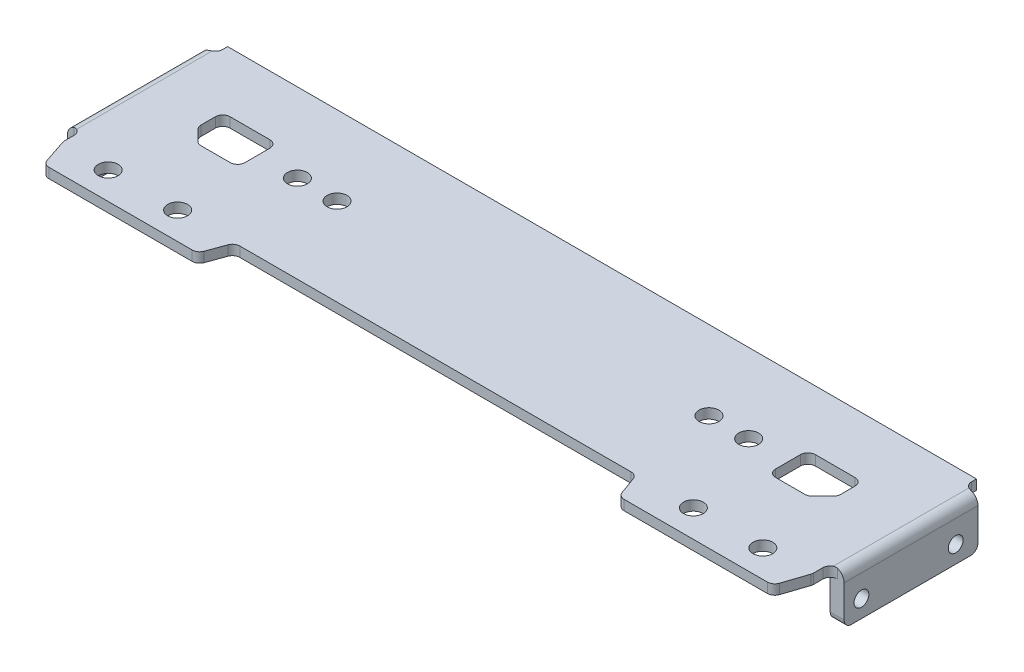
from build123d import *

# Parameters (mm, degrees)
SKETCH1_R           = 2
BOSS_EXTRUDE1_DEPTH = 2
SKETCH2_W           = 2.8
SKETCH2_H           = 27
BOSS_EXTRUDE2_DEPTH = 10
SKETCH3_R           = 1.5
CUT_EXTRUDE1_DEPTH  = 114.824325613
FILLET1_R           = 1.5
FILLET2_R           = 2
SKETCH4_W           = 118.780737261
SKETCH4_H           = 53.902552227
CUT_EXTRUDE2_DEPTH  = 171
SKETCH5_W           = 33.594975397
SKETCH5_H           = 2
BOSS_EXTRUDE3_DEPTH = 25


with BuildPart() as part:
    # Sketch1 → Boss-Extrude1 (new body)
    with BuildSketch(Plane(origin=(0, 0, 0), x_dir=(1, 0, 0), z_dir=(0, 1, 0))):
        Polygon((0, 6), (2, 0), (33, 0), (35, 5.5), (66, 5.5), (68, 0), (99, 0), (101, 6), (101, 39.094975397), (0, 39.094975397), align=None)
        with Locations(Location((9.5, 5.5, 0), (0, 0, 270))):
            Circle(SKETCH1_R, mode=Mode.SUBTRACT)
        with Locations(Location((23.5, 5.5, 0), (0, 0, 270))):
            Circle(SKETCH1_R, mode=Mode.SUBTRACT)
        with Locations(Location((77.5, 5.5, 0), (0, 0, 90))):
            Circle(SKETCH1_R, mode=Mode.SUBTRACT)
        with Locations(Location((91.5, 5.5, 0), (0, 0, 90))):
            Circle(SKETCH1_R, mode=Mode.SUBTRACT)
        with Locations(Location((30, 23.149785568, 0), (0, 0, 270))):
            Circle(SKETCH1_R, mode=Mode.SUBTRACT)
        with Locations(Location((38, 23.149785568, 0), (0, 0, 270))):
            Circle(SKETCH1_R, mode=Mode.SUBTRACT)
        with Locations(Location((63, 23.149785568, 0), (0, 0, 90))):
            Circle(SKETCH1_R, mode=Mode.SUBTRACT)
        with Locations(Location((71, 23.149785568, 0), (0, 0, 90))):
            Circle(SKETCH1_R, mode=Mode.SUBTRACT)
        Polygon((11, 22.094975397), (14, 19.094975397), (22, 19.094975397), (22, 27.094975397), (11, 27.094975397), align=None, mode=Mode.SUBTRACT)
        Polygon((90, 27.094975397), (90, 22.094975397), (87, 19.094975397), (79, 19.094975397), (79, 27.094975397), align=None, mode=Mode.SUBTRACT)
    extrude(amount=BOSS_EXTRUDE1_DEPTH)

    # Sketch2 → Boss-Extrude2 (add)
    with BuildSketch(Plane(origin=(0, 2, 0), x_dir=(1, 0, 0), z_dir=(0, 1, 0))):
        with Locations((-1.4, 23.094975397)):
            Rectangle(SKETCH2_W, SKETCH2_H)
        with Locations((102.4, 23.094975397)):
            Rectangle(SKETCH2_W, SKETCH2_H)
    extrude(amount=-BOSS_EXTRUDE2_DEPTH)

    # Sketch3 → Cut-Extrude1 (cut, through all)
    with BuildSketch(Plane(origin=(103.8, 0, 0), x_dir=(0, 0, -1), z_dir=(1, 0, 0))):
        with Locations((13.094975397, -4.5)):
            Circle(SKETCH3_R)
        with Locations((32.094975397, -4.5)):
            Circle(SKETCH3_R)
    extrude(amount=-CUT_EXTRUDE1_DEPTH, mode=Mode.SUBTRACT)

    # Fillet1
    fillet1_edges = [part.edges().sort_by_distance(p)[0] for p in [
        (-1.4, -8, -9.594975397),
        (-1.4, -8, -36.594975397),
        (0, 1, -9.594975397),
        (0, 1, -6),
        (2, 1, 0),
        (0, 1, -36.594975397),
        (102.4, -8, -36.594975397),
        (101, 1, -36.594975397),
        (102.4, -8, -9.594975397),
        (101, 1, -9.594975397),
        (101, 1, -6),
        (99, 1, 0),
        (66, 1, -5.5),
        (68, 1, 0),
        (90, 1, -27.094975397),
        (79, 1, -27.094975397),
        (90, 1, -22.094975397),
        (87, 1, -19.094975397),
        (79, 1, -19.094975397),
        (35, 1, -5.5),
        (33, 1, 0),
        (11, 1, -27.094975397),
        (11, 1, -22.094975397),
        (14, 1, -19.094975397),
        (22, 1, -19.094975397),
        (22, 1, -27.094975397),
    ]]
    fillet(fillet1_edges, radius=FILLET1_R)

    # Fillet2
    fillet2_edges = [part.edges().sort_by_distance(p)[0] for p in [
        (-2.8, 2, -23.094975397),
        (103.8, 2, -23.094975397),
    ]]
    fillet(fillet2_edges, radius=FILLET2_R)

    # Sketch4 → Cut-Extrude2 (cut)
    with BuildSketch(Plane(origin=(50.5, 0, 0), x_dir=(0, 0, -1), z_dir=(1, 0, 0))):
        with Locations((-7.200535956, 8.280511496)):
            Rectangle(SKETCH4_W, SKETCH4_H)
    extrude(amount=CUT_EXTRUDE2_DEPTH, mode=Mode.SUBTRACT)

    # Sketch5 → Boss-Extrude3 (add)
    with BuildSketch(Plane(origin=(50.5, 0, 0), x_dir=(0, 0, -1), z_dir=(1, 0, 0))):
        with Locations((22.297487698, 1)):
            Rectangle(SKETCH5_W, SKETCH5_H)
    extrude(amount=BOSS_EXTRUDE3_DEPTH)

    # Mirror1: part across plane


with BuildPart() as part_1:
    add(part.part)
    add(part.part.mirror(Plane(origin=(75.5, 0, 0), x_dir=(0, 0, 1), z_dir=(1, 0, 0))))


solid = part_1.part
